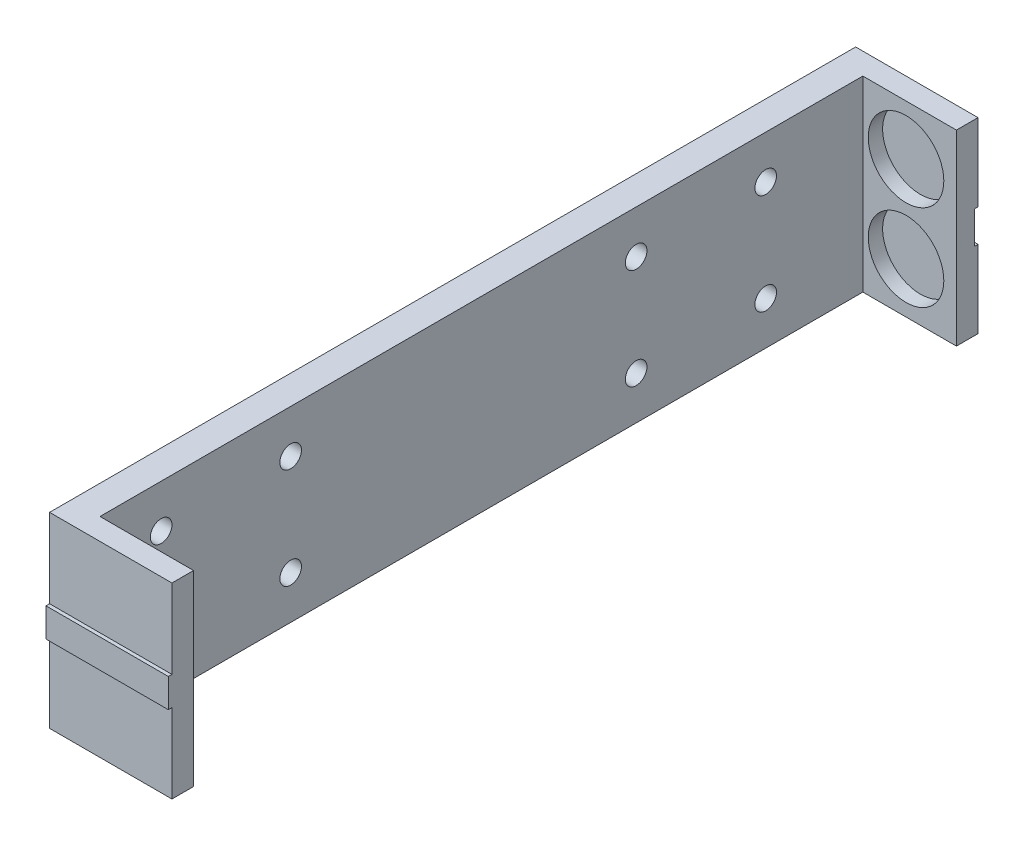
from build123d import *

# Parameters (mm, degrees)
ESQUISSE1_W             = 17
ESQUISSE1_H             = 26
BOSS_EXTRU_1_DEPTH      = 3
ESQUISSE3_W             = 4
ESQUISSE3_H             = 26
BOSS_EXTRU_2_DEPTH      = 109
ESQUISSE4_R             = 1.5
ENL_V_MAT_EXTRU_2_DEPTH = 4
ESQUISSE5_R             = 1.5
ENL_V_MAT_EXTRU_3_DEPTH = 4
ESQUISSE6_W             = 3
ESQUISSE6_H             = 26
BOSS_EXTRU_3_DEPTH      = 13
ESQUISSE8_R             = 5.25
ENL_V_MAT_EXTRU_4_DEPTH = 2
ENL_V_START             = -2
ESQUISSE9_R             = 5.25
ENL_V_MAT_EXTRU_5_DEPTH = 2
ESQUISSE10_W            = 17
ESQUISSE10_H            = 4
BOSS_EXTRU_5_DEPTH      = 0.5
ESQUISSE11_W            = 17
ESQUISSE11_H            = 4.5
ENL_V_MAT_EXTRU_6_DEPTH = 0.5


with BuildPart() as part:
    # Esquisse1 → Boss.-Extru.1 (new body)
    with BuildSketch(Plane.XY):
        with Locations((8.5, 13)):
            Rectangle(ESQUISSE1_W, ESQUISSE1_H)
    extrude(amount=BOSS_EXTRU_1_DEPTH)

    # Esquisse3 → Boss.-Extru.2 (add)
    with BuildSketch(Plane(origin=(0, 0, 0), x_dir=(-1, 0, 0), z_dir=(0, 0, -1))):
        with Locations((-2, 13)):
            Rectangle(ESQUISSE3_W, ESQUISSE3_H)
    extrude(amount=BOSS_EXTRU_2_DEPTH)

    # Esquisse4 → Enlèv. mat.-Extru.2 (cut)
    with BuildSketch(Plane.ZY):
        with Locations((-8.5, 20)):
            Circle(ESQUISSE4_R)
        with Locations((-8.5, 6)):
            Circle(ESQUISSE4_R)
        with Locations((-26.496682549, 20)):
            Circle(ESQUISSE4_R)
        with Locations((-26.496682549, 6)):
            Circle(ESQUISSE4_R)
    extrude(amount=-ENL_V_MAT_EXTRU_2_DEPTH, mode=Mode.SUBTRACT)

    # Esquisse5 → Enlèv. mat.-Extru.3 (cut)
    with BuildSketch(Plane.ZY):
        with Locations((-92.5, 19.999545392)):
            Circle(ESQUISSE5_R)
        with Locations((-92.5, 6)):
            Circle(ESQUISSE5_R)
        with Locations((-74.5, 19.999545392)):
            Circle(ESQUISSE5_R)
        with Locations((-74.5, 6)):
            Circle(ESQUISSE5_R)
    extrude(amount=-ENL_V_MAT_EXTRU_3_DEPTH, mode=Mode.SUBTRACT)

    # Esquisse6 → Boss.-Extru.3 (add)
    with BuildSketch(Plane(origin=(4, 0, 0), x_dir=(0, 0, -1), z_dir=(1, 0, 0))):
        with Locations((107.5, 13)):
            Rectangle(ESQUISSE6_W, ESQUISSE6_H)
    extrude(amount=BOSS_EXTRU_3_DEPTH)

    # Esquisse8 → Enlèv. mat.-Extru.4 (cut)
    with BuildSketch(Plane(origin=(0, 0, 0), x_dir=(-1, 0, 0), z_dir=(0, 0, -1))):
        with Locations((-10, 7)):
            Circle(ESQUISSE8_R)
        with Locations((-10, 19)):
            Circle(ESQUISSE8_R)
    extrude(amount=-ENL_V_MAT_EXTRU_4_DEPTH, mode=Mode.SUBTRACT)

    # Esquisse9 → Enlèv. mat.-Extru.5 (cut)
    with BuildSketch(Plane.XY.offset(-106).offset(ENL_V_START)):
        with Locations(Location((10, 19, 0), (0, 0, 180))):
            Circle(ESQUISSE9_R)
        with Locations(Location((10, 7, 0), (0, 0, 180))):
            Circle(ESQUISSE9_R)
    extrude(amount=ENL_V_MAT_EXTRU_5_DEPTH, mode=Mode.SUBTRACT)

    # Esquisse10 → Boss.-Extru.5 (add)
    with BuildSketch(Plane.XY.offset(3)):
        with Locations((8.5, 13)):
            Rectangle(ESQUISSE10_W, ESQUISSE10_H)
    extrude(amount=BOSS_EXTRU_5_DEPTH)

    # Esquisse11 → Enlèv. mat.-Extru.6 (cut)
    with BuildSketch(Plane(origin=(0, 0, -109), x_dir=(-1, 0, 0), z_dir=(0, 0, -1))):
        with Locations((-8.5, 13)):
            Rectangle(ESQUISSE11_W, ESQUISSE11_H)
    extrude(amount=-ENL_V_MAT_EXTRU_6_DEPTH, mode=Mode.SUBTRACT)


solid = part.part
